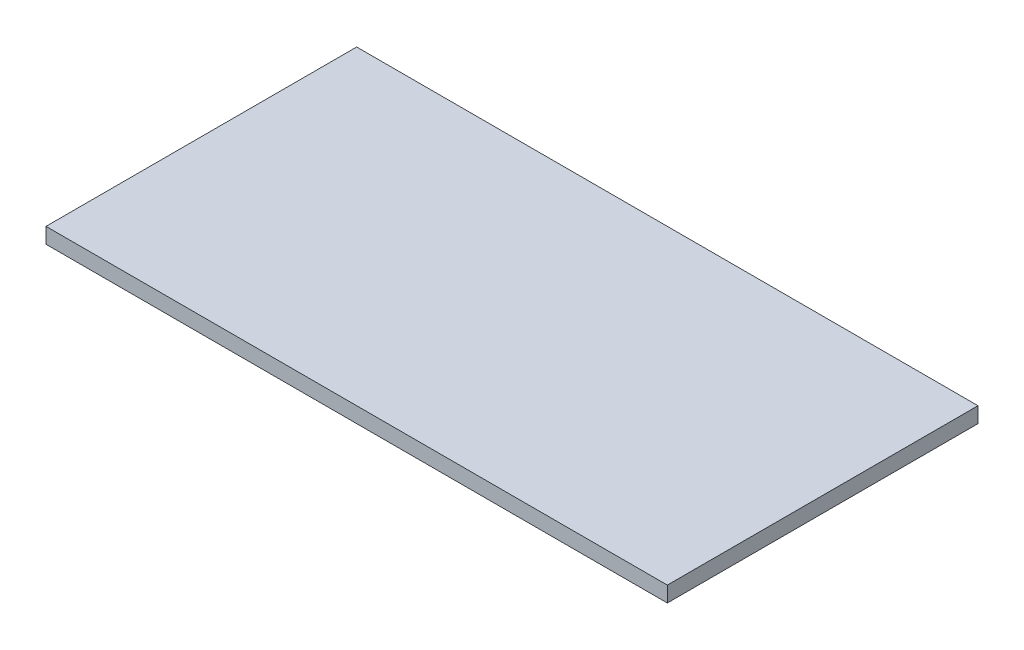
from build123d import *

# Parameters (mm, degrees)
SKETCH1_W           = 1016
SKETCH1_H           = 508
BOSS_EXTRUDE1_DEPTH = 25.4


with BuildPart() as part:
    # Sketch1 → Boss-Extrude1 (new body)
    with BuildSketch(Plane(origin=(0, 0, 0), x_dir=(1, 0, 0), z_dir=(0, 1, 0))):
        with Locations((508, 254)):
            Rectangle(SKETCH1_W, SKETCH1_H)
    extrude(amount=BOSS_EXTRUDE1_DEPTH)


solid = part.part
